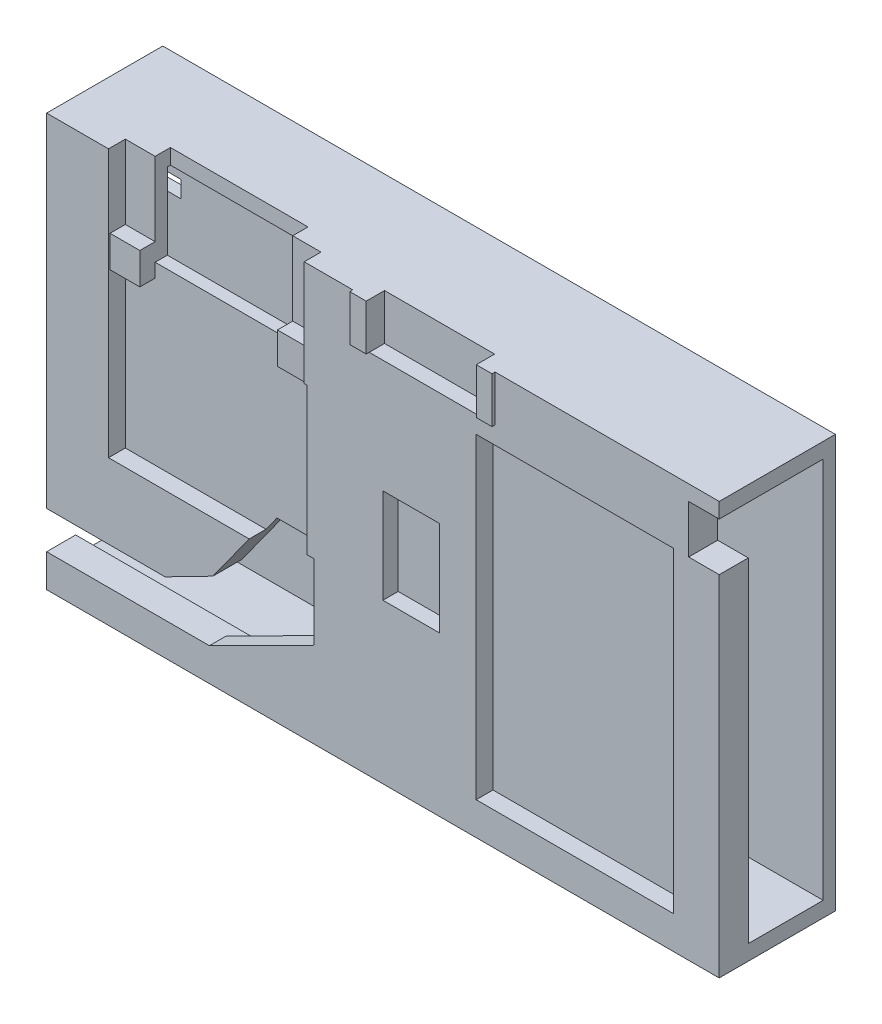
from build123d import *

# Parameters (mm, degrees)
ESQUISSE1_W              = 44
ESQUISSE1_H              = 25
BOSS_EXTRU_1_DEPTH       = 1.9
ESQUISSE2_W              = 18
ESQUISSE2_H              = 21.4
ESQUISSE2_W_2            = 12.9
ESQUISSE2_H_2            = 20.7
ENL_V_MAT_EXTRU_1_DEPTH  = 1.1
ESQUISSE3_W              = 9
ESQUISSE3_H              = 12
ENL_V_MAT_EXTRU_2_DEPTH  = 10
ESQUISSE4_W              = 3.5
ESQUISSE4_H              = 6.801352385
ENL_V_MAT_EXTRU_3_DEPTH  = 1.4
ENL_V_MAT_EXTRU_4_DEPTH  = 2.4
ESQUISSE6_W              = 9
ESQUISSE6_H              = 0.8
BOSS_EXTRU_2_DEPTH       = 1
ESQUISSE7_W              = 2
ESQUISSE7_H              = 1.1
BOSS_EXTRU_3_DEPTH       = 1
BOSS_EXTRU_4_DEPTH       = 1
ESQUISSE12_W             = 26.5
ESQUISSE12_H             = 1.9
BOSS_EXTRU_6_DEPTH       = 1
ESQUISSE13_W             = 44
ESQUISSE13_H             = 1
BOSS_EXTRU_7_DEPTH       = 4.9
ESQUISSE14_W             = 44
ESQUISSE14_H             = 27
BOSS_EXTRU_8_DEPTH       = 0.8
ESQUISSE15_W             = 9
ESQUISSE15_H             = 1
ENL_V_MAT_EXTRU_5_DEPTH  = 0.2
ESQUISSE16_W             = 0.8
ESQUISSE16_H             = 1.1
ENL_V_MAT_EXTRU_7_DEPTH  = 2
ESQUISSE18_W             = 1.9
ESQUISSE18_H             = 3.15
ENL_V_MAT_EXTRU_8_DEPTH  = 2
ESQUISSE19_W             = 1
ESQUISSE19_H             = 25
BOSS_EXTRU_10_DEPTH      = 4.9
ENL_V_MAT_EXTRU_9_DEPTH  = 1
ESQUISSE21_W             = 1.9
ESQUISSE21_H             = 2.150656269
BOSS_EXTRU_11_DEPTH      = 17.5
BOSS_EXTRU_12_DEPTH      = 1.1
BOSS_EXTRU_13_DEPTH      = 1.1
ESQUISSE26_W             = 12.9
ESQUISSE26_H             = 17.5
ENL_V_MAT_EXTRU_10_DEPTH = 1.1
ESQUISSE28_W             = 4.9
ESQUISSE28_H             = 25
ENL_V_MAT_EXTRU_12_DEPTH = 10
ESQUISSE30_W             = 4.9
ESQUISSE30_H             = 25
BOSS_EXTRU_14_DEPTH      = 1
ESQUISSE31_W             = 4.9
ESQUISSE31_H             = 4.778042902
ESQUISSE31_H_2           = 4.777647835
ENL_V_MAT_EXTRU_13_DEPTH = 11
ESQUISSE32_W             = 2
ESQUISSE32_H             = 1.1
ENL_V_MAT_EXTRU_14_DEPTH = 5
ESQUISSE33_W             = 4.880014168
ESQUISSE33_H             = 9.610289291
ENL_V_MAT_EXTRU_15_DEPTH = 5
ESQUISSE34_W             = 1.1
ESQUISSE34_H             = 10.612062874
ENL_V_MAT_EXTRU_16_DEPTH = 5
ESQUISSE35_W             = 1.1
ESQUISSE35_H             = 16.502088347
BOSS_EXTRU_15_DEPTH      = 0.1
ESQUISSE36_W             = 1.95
ESQUISSE36_H             = 2.065080621
ESQUISSE36_W_2           = 1.843442291
BOSS_EXTRU_16_DEPTH      = 1
ESQUISSE40_W             = 3.7
ESQUISSE40_H             = 6.2
ENL_V_MAT_EXTRU_18_DEPTH = 1
ESQUISSE39_W             = 7.2
ESQUISSE39_H             = 3
ENL_V_MAT_EXTRU_20_DEPTH = 1
ESQUISSE41_W             = 1.072034993
ESQUISSE41_H             = 2.997764605
ESQUISSE41_W_2           = 1.033542433
BOSS_EXTRU_17_DEPTH      = 0.2
ESQUISSE42_W             = 1.1
ESQUISSE42_H             = 9.602531403
ENL_V_MAT_EXTRU_21_DEPTH = 0.2


with BuildPart() as part:
    # Esquisse1 → Boss.-Extru.1 (new body)
    with BuildSketch(Plane.XY):
        Rectangle(ESQUISSE1_W, ESQUISSE1_H)
    extrude(amount=BOSS_EXTRU_1_DEPTH)

    # Esquisse2 → Enlèv. mat.-Extru.1 (cut)
    with BuildSketch(Plane.XY.offset(1.9)):
        with Locations((-11.5, 1.801352385)):
            Rectangle(ESQUISSE2_W, ESQUISSE2_H)
        with Locations((12.55, -0.999343731)):
            Rectangle(ESQUISSE2_W_2, ESQUISSE2_H_2)
    extrude(amount=-ENL_V_MAT_EXTRU_1_DEPTH, mode=Mode.SUBTRACT)

    # Esquisse3 → Enlèv. mat.-Extru.2 (cut)
    with BuildSketch(Plane.XY.offset(0.8)):
        with Locations((-11.5, 12.5)):
            Rectangle(ESQUISSE3_W, ESQUISSE3_H)
    extrude(amount=-ENL_V_MAT_EXTRU_2_DEPTH, mode=Mode.SUBTRACT)

    # Esquisse4 → Enlèv. mat.-Extru.3 (cut)
    with BuildSketch(Plane.XY.offset(1.9)):
        with Locations((-6.25, -9.099323807)):
            Rectangle(ESQUISSE4_W, ESQUISSE4_H)
    extrude(amount=-ENL_V_MAT_EXTRU_3_DEPTH, mode=Mode.SUBTRACT)

    # Esquisse5 → Enlèv. mat.-Extru.4 (cut)
    with BuildSketch(Plane.XY.offset(1.9)):
        Polygon((-8, -5.698647615), (-14.25, -8.898647615), (-22, -8.898647615), (-22, -12.5), (-4.5, -12.5), (-4.5, -5.698647615), align=None)
    extrude(amount=-ENL_V_MAT_EXTRU_4_DEPTH, mode=Mode.SUBTRACT)

    # Esquisse6 → Boss.-Extru.2 (add)
    with BuildSketch(Plane(origin=(0, 6.5, 0), x_dir=(1, 0, 0), z_dir=(0, 1, 0))):
        with Locations((-11.5, -0.4)):
            Rectangle(ESQUISSE6_W, ESQUISSE6_H)
    extrude(amount=BOSS_EXTRU_2_DEPTH)

    # Esquisse7 → Boss.-Extru.3 (add)
    with BuildSketch(Plane(origin=(0, -8.898647615, 0), x_dir=(1, 0, 0), z_dir=(0, 1, 0))):
        with Locations((-3.5, -1.35)):
            Rectangle(ESQUISSE7_W, ESQUISSE7_H)
    extrude(amount=BOSS_EXTRU_3_DEPTH)

    # Esquisse9 → Boss.-Extru.4 (add)
    with BuildSketch(Plane(origin=(0, 12.5, 0), x_dir=(1, 0, 0), z_dir=(0, 1, 0))):
        Polygon((22, 0), (-2.5, 0), (-7, 0), (-7, -0.8), (-2.5, -0.8), (-2.5, -1.9), (22, -1.9), align=None)
        Polygon((-22, 0), (-20.5, 0), (-16, 0), (-16, -0.8), (-20.5, -0.8), (-20.5, -1.9), (-22, -1.9), align=None)
    extrude(amount=BOSS_EXTRU_4_DEPTH)

    # Esquisse12 → Boss.-Extru.6 (add)
    with BuildSketch(Plane.XZ.offset(12.5)):
        with Locations((8.75, 0.95)):
            Rectangle(ESQUISSE12_W, ESQUISSE12_H)
    extrude(amount=BOSS_EXTRU_6_DEPTH)

    # Esquisse13 → Boss.-Extru.7 (add)
    with BuildSketch(Plane(origin=(0, 0, 0), x_dir=(-1, 0, 0), z_dir=(0, 0, -1))):
        with Locations((0, 13)):
            Rectangle(ESQUISSE13_W, ESQUISSE13_H)
        with Locations((0, -13)):
            Rectangle(ESQUISSE13_W, ESQUISSE13_H)
    extrude(amount=BOSS_EXTRU_7_DEPTH)

    # Esquisse14 → Boss.-Extru.8 (add)
    with BuildSketch(Plane(origin=(0, 0, -4.9), x_dir=(-1, 0, 0), z_dir=(0, 0, -1))):
        Rectangle(ESQUISSE14_W, ESQUISSE14_H)
    extrude(amount=BOSS_EXTRU_8_DEPTH)

    # Esquisse15 → Enlèv. mat.-Extru.5 (cut)
    with BuildSketch(Plane.XY):
        with Locations((-11.5, 13)):
            Rectangle(ESQUISSE15_W, ESQUISSE15_H)
    extrude(amount=-ENL_V_MAT_EXTRU_5_DEPTH, mode=Mode.SUBTRACT)

    # Esquisse16 → Enlèv. mat.-Extru.7 (cut)
    with BuildSketch(Plane.ZY.offset(22)):
        with Locations((-5.3, 11.95)):
            Rectangle(ESQUISSE16_W, ESQUISSE16_H)
    extrude(amount=-ENL_V_MAT_EXTRU_7_DEPTH, mode=Mode.SUBTRACT)

    # Esquisse18 → Enlèv. mat.-Extru.8 (cut)
    with BuildSketch(Plane(origin=(22, 0, 0), x_dir=(0, 0, -1), z_dir=(1, 0, 0))):
        with Locations((-0.95, 10.925)):
            Rectangle(ESQUISSE18_W, ESQUISSE18_H)
    extrude(amount=-ENL_V_MAT_EXTRU_8_DEPTH, mode=Mode.SUBTRACT)

    # Esquisse19 → Boss.-Extru.10 (add)
    with BuildSketch(Plane.XY.offset(-4.9)):
        with Locations((-19.5, 0)):
            Rectangle(ESQUISSE19_W, ESQUISSE19_H)
    extrude(amount=BOSS_EXTRU_10_DEPTH)

    # Esquisse20 → Enlèv. mat.-Extru.9 (cut)
    with BuildSketch(Plane.XY.offset(0.8)):
        Polygon((-4.5, -5.776745759), (-4.5, -3.002088347), (-8.02831202, -3.002088347), (-11.125, -7.298647615), align=None)
    extrude(amount=-ENL_V_MAT_EXTRU_9_DEPTH, mode=Mode.SUBTRACT)

    # Esquisse21 → Boss.-Extru.11 (add)
    with BuildSketch(Plane.ZY.offset(4.5)):
        with Locations((0.95, -12.424671866)):
            Rectangle(ESQUISSE21_W, ESQUISSE21_H)
    extrude(amount=BOSS_EXTRU_11_DEPTH)

    # Esquisse23 → Boss.-Extru.12 (add)
    with BuildSketch(Plane.XY.offset(0.8)):
        Polygon((-4.5, -7.898647615), (-11.348803677, -11.349343731), (-4.5, -11.349343731), align=None)
    extrude(amount=BOSS_EXTRU_12_DEPTH)

    # Esquisse25 → Boss.-Extru.13 (add)
    with BuildSketch(Plane.XY.offset(0.8)):
        Polygon((-16, 13.5), (-20.5, 13.5), (-20.5, -8.898647615), (-14.25, -8.898647615), (-11.125, -7.298647615), (-8.02831202, -3.002088347), (-4.5, -3.002088347), (-4.5, -7.898647615), (-2.5, -7.898647615), (-2.5, 13.5), (-7, 13.5), (-7, 7.5), (-16, 7.5), align=None)
    extrude(amount=BOSS_EXTRU_13_DEPTH)

    # Esquisse26 → Enlèv. mat.-Extru.10 (cut)
    with BuildSketch(Plane.XY.offset(1.9)):
        with Locations((-11.5, 4.75)):
            Rectangle(ESQUISSE26_W, ESQUISSE26_H)
    extrude(amount=-ENL_V_MAT_EXTRU_10_DEPTH, mode=Mode.SUBTRACT)

    # Esquisse28 → Enlèv. mat.-Extru.12 (cut)
    with BuildSketch(Plane.ZY.offset(20)):
        with Locations((-2.45, 0)):
            Rectangle(ESQUISSE28_W, ESQUISSE28_H)
    extrude(amount=-ENL_V_MAT_EXTRU_12_DEPTH, mode=Mode.SUBTRACT)

    # Esquisse30 → Boss.-Extru.14 (add)
    with BuildSketch(Plane.ZY.offset(22)):
        with Locations((-2.45, 0)):
            Rectangle(ESQUISSE30_W, ESQUISSE30_H)
    extrude(amount=-BOSS_EXTRU_14_DEPTH)

    # Esquisse31 → Enlèv. mat.-Extru.13 (cut)
    with BuildSketch(Plane(origin=(-21, 0, 0), x_dir=(0, 0, -1), z_dir=(1, 0, 0))):
        with Locations((2.45, 10.110978549)):
            Rectangle(ESQUISSE31_W, ESQUISSE31_H)
        with Locations((2.45, -10.111176083)):
            Rectangle(ESQUISSE31_W, ESQUISSE31_H_2)
    extrude(amount=-ENL_V_MAT_EXTRU_13_DEPTH, mode=Mode.SUBTRACT)

    # Esquisse32 → Enlèv. mat.-Extru.14 (cut)
    with BuildSketch(Plane(origin=(0, 0, -5.7), x_dir=(-1, 0, 0), z_dir=(0, 0, -1))):
        with Locations((21, 9.515350227)):
            Rectangle(ESQUISSE32_W, ESQUISSE32_H)
        with Locations((21, 6.785575873)):
            Rectangle(ESQUISSE32_W, ESQUISSE32_H)
    extrude(amount=-ENL_V_MAT_EXTRU_14_DEPTH, mode=Mode.SUBTRACT)

    # Esquisse33 → Enlèv. mat.-Extru.15 (cut)
    with BuildSketch(Plane.ZY.offset(22)):
        with Locations((-2.440007084, 7.694855354)):
            Rectangle(ESQUISSE33_W, ESQUISSE33_H)
    extrude(amount=-ENL_V_MAT_EXTRU_15_DEPTH, mode=Mode.SUBTRACT)

    # Esquisse34 → Enlèv. mat.-Extru.16 (cut)
    with BuildSketch(Plane.ZY.offset(22)):
        with Locations((-2.596187743, -2.416320728)):
            Rectangle(ESQUISSE34_W, ESQUISSE34_H)
    extrude(amount=-ENL_V_MAT_EXTRU_16_DEPTH, mode=Mode.SUBTRACT)

    # Esquisse35 → Boss.-Extru.15 (add)
    with BuildSketch(Plane.ZY.offset(5.05)):
        with Locations((1.35, 5.248955826)):
            Rectangle(ESQUISSE35_W, ESQUISSE35_H)
    extrude(amount=BOSS_EXTRU_15_DEPTH)

    # Esquisse36 → Boss.-Extru.16 (add)
    with BuildSketch(Plane.XY.offset(0.8)):
        with Locations((-16.975, 7.632540311)):
            Rectangle(ESQUISSE36_W, ESQUISSE36_H)
        with Locations((-6.078278855, 7.632540311)):
            Rectangle(ESQUISSE36_W_2, ESQUISSE36_H)
    extrude(amount=BOSS_EXTRU_16_DEPTH)

    # Esquisse40 → Enlèv. mat.-Extru.18 (cut)
    with BuildSketch(Plane.XY.offset(1.9)):
        with Locations((1.85, 0)):
            Rectangle(ESQUISSE40_W, ESQUISSE40_H)
    extrude(amount=-ENL_V_MAT_EXTRU_18_DEPTH, mode=Mode.SUBTRACT)

    # Esquisse39 → Enlèv. mat.-Extru.20 (cut)
    with BuildSketch(Plane.XY.offset(1.9)):
        with Locations((2.705958025, 12)):
            Rectangle(ESQUISSE39_W, ESQUISSE39_H)
    extrude(amount=-ENL_V_MAT_EXTRU_20_DEPTH, mode=Mode.SUBTRACT)

    # Esquisse41 → Boss.-Extru.17 (add)
    with BuildSketch(Plane.XY.offset(1.9)):
        with Locations((-1.430059472, 12.001117697)):
            Rectangle(ESQUISSE41_W, ESQUISSE41_H)
        with Locations((6.822729242, 12.001117697)):
            Rectangle(ESQUISSE41_W_2, ESQUISSE41_H)
    extrude(amount=BOSS_EXTRU_17_DEPTH)

    # Esquisse42 → Enlèv. mat.-Extru.21 (cut)
    with BuildSketch(Plane.ZY.offset(5.15)):
        with Locations((1.35, 1.799177355)):
            Rectangle(ESQUISSE42_W, ESQUISSE42_H)
    extrude(amount=-ENL_V_MAT_EXTRU_21_DEPTH, mode=Mode.SUBTRACT)


solid = part.part
